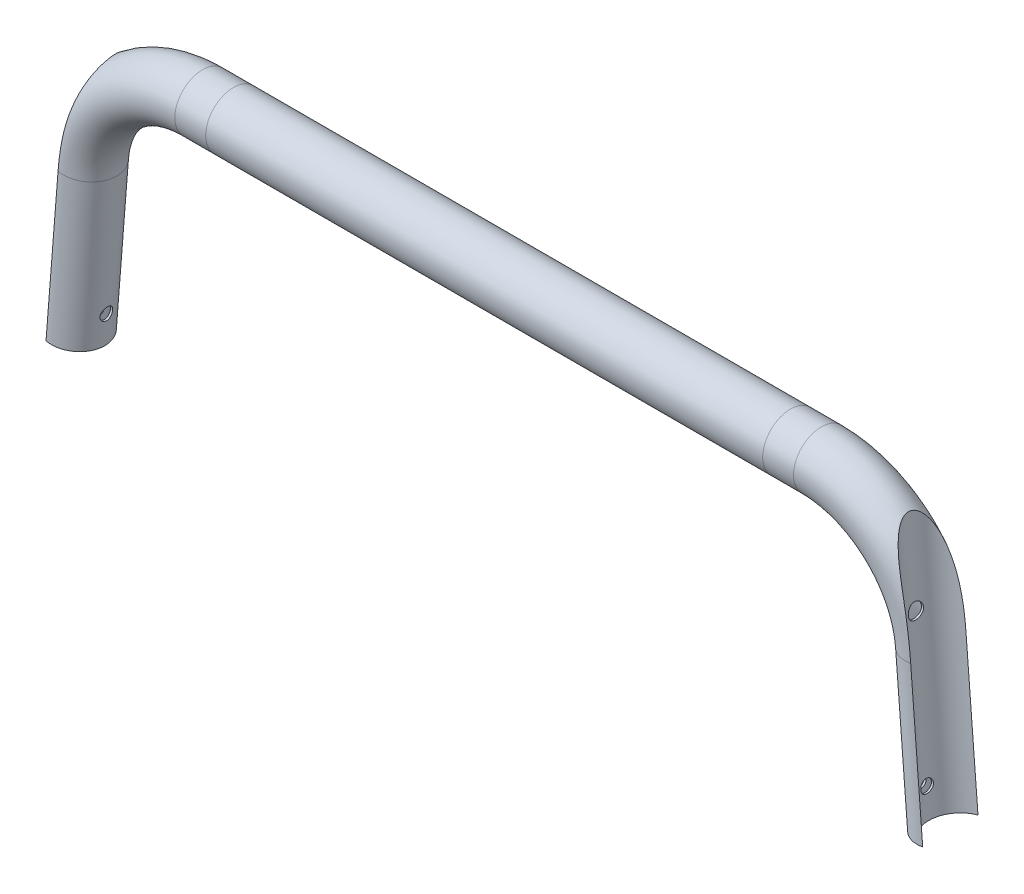
from build123d import *

# Parameters (mm, degrees)
SKETCH2_R               = 11
SKETCH2_R_2             = 10.2
SKETCH3_R               = 11.23581799789534
CUT_EXTRUDE1_DEPTH      = 230.5845222963601
BOSS_EXTRUDE1_REACH     = 223.606
CUT_EXTRUDE2_REACH      = 365.113
CUT_EXTRUDE2_END_RADIUS = 11.00000000000001
SKETCH8_R               = 2.5000000000000004
CUT_EXTRUDE3_REACH      = 369.953
CUT_EXTRUDE3_END_RADIUS = 12.035817997895382
SKETCH9_R               = 3.000000000000001


with BuildPart() as part:
    # Sweep1: sweep along a path in Sketch1
    with BuildLine(Plane.XY) as sweep1_path:
        Line((-171.8, -101.9), (-167.04400396794307, -41.46934069224712))
        ThreePointArc((-167.04400396794307, -41.46934069224712), (-152.7287574989347, -11.955487075394196), (-122.18272394995228, 0))
        Line((-122.18272394995228, 0), (-110, 1.01e-15))
        Line((-110, 1.01e-15), (110, 1.01e-15))
        Line((110, 1.01e-15), (122.18272394995228, 0))
        ThreePointArc((122.18272394995228, 0), (152.72875749893473, -11.955487075394181), (167.04400396794307, -41.46934069224712))
        Line((167.04400396794307, -41.46934069224712), (171.8, -101.9))
    # Sketch2 → Sweep1 (sweep)
    with BuildSketch(Plane(origin=(-171.79999999999998, -101.90000000000002, 0), x_dir=(-0.9969173337331282, 0.07845909572784168, 0), z_dir=(-0.07845909572784168, -0.9969173337331282, 0))):
        Circle(SKETCH2_R)
        Circle(SKETCH2_R_2, mode=Mode.SUBTRACT)
    sweep(path=sweep1_path.line)

    # Sketch3 → Cut-Extrude1 (cut, through all)
    with BuildSketch(Plane(origin=(9.02790753667694, -114.71044150027745, 0), x_dir=(0.9969173337331282, 0.07845909572784168, 0), z_dir=(0.07845909572784168, -0.9969173337331282, 0))):
        with Locations((167.27541608068444, 0)):
            Circle(SKETCH3_R)
    cut_extrude1 = extrude(amount=-CUT_EXTRUDE1_DEPTH, mode=Mode.SUBTRACT)

    # Mirror1: Cut-Extrude1 across plane
    add(cut_extrude1.mirror(Plane(origin=(0, 0, 0), x_dir=(0, 0, 1), z_dir=(1, 0, 0))), mode=Mode.SUBTRACT)

    # Sketch6 → Boss-Extrude1 (add, up to next)
    with BuildSketch(Plane(origin=(9.027907536676944, -114.71044150027747, 0), x_dir=(0.9969173337331283, 0.07845909572784171, 0), z_dir=(0.07845909572784171, -0.9969173337331283, 0)), mode=Mode.PRIVATE) as boss_extrude1_sk1:
        with BuildLine():
            ThreePointArc((163.21850968110442, 10.477839307169974), (156.03959808278907, 1.38e-15), (163.21850968110442, -10.477839307169974))
            ThreePointArc((163.21850968110442, -10.477839307169974), (162.0472251297871, -10.405762916447943), (160.89134608152528, -10.203164466198636))
            ThreePointArc((160.89134608152528, -10.203164466198636), (155.23959808278906, 1.216e-14), (160.8913460815253, 10.203164466198638))
            ThreePointArc((160.8913460815253, 10.203164466198638), (162.04722512978714, 10.405762916447944), (163.21850968110442, 10.477839307169974))
        make_face()
    boss_extrude1_tool1 = extrude(boss_extrude1_sk1.sketch, amount=-BOSS_EXTRUDE1_REACH, mode=Mode.PRIVATE) - part.part
    boss_extrude1 = boss_extrude1_tool1.solids().sort_by_distance((170.601798, -101.994301, -10.183076))[0]
    add(boss_extrude1)

    # Mirror2: Boss-Extrude1 across plane
    add(boss_extrude1.mirror(Plane(origin=(0, 0, 0), x_dir=(0, 0, 1), z_dir=(1, 0, 0))))

    # Cut-Extrude2: up to this cylinder (the profile starts inside it)
    cut_extrude2_end = Plane(origin=(170.9053944688506, -90.53295896310067, 0), z_dir=(0.07845909572784143, -0.9969173337331283, 0)) * Cylinder(CUT_EXTRUDE2_END_RADIUS, 753.226, mode=Mode.PRIVATE)
    # Sketch8 → Cut-Extrude2 (cut, up to the surface)
    with BuildSketch(Plane(origin=(171.80000000000013, -101.89999999999986, 0), x_dir=(7.6e-16, 6e-17, -1), z_dir=(0.9969173337331283, 0.0784590957278417, 0)), mode=Mode.PRIVATE) as cut_extrude2_sk1:
        with Locations(Location((0, 11.40218999047264, 0), (0, 0, 90))):
            Circle(SKETCH8_R)
    cut_extrude2_tool1 = extrude(cut_extrude2_sk1.sketch, amount=-CUT_EXTRUDE2_REACH, mode=Mode.PRIVATE) & cut_extrude2_end
    cut_extrude2 = cut_extrude2_tool1.solids().sort_by_distance((170.905394, -90.532959, 0))[0]
    add(cut_extrude2, mode=Mode.SUBTRACT)

    # Mirror3: Cut-Extrude2 across plane
    add(cut_extrude2.mirror(Plane(origin=(0, 0, 0), x_dir=(0, 0, 1), z_dir=(1, 0, 0))), mode=Mode.SUBTRACT)

    # Cut-Extrude3: up to this cylinder (the profile starts inside it)
    cut_extrude3_end = Plane(origin=(170.48377311118142, -34.19377229868032, 0), z_dir=(0.07845909572784171, -0.9969173337331282, 0)) * Cylinder(CUT_EXTRUDE3_END_RADIUS, 764.9776359957907, mode=Mode.PRIVATE)
    # Sketch9 → Cut-Extrude3 (cut, up to the surface)
    with BuildSketch(Plane(origin=(180, 0, 0), x_dir=(0, 0, -1), z_dir=(1, 0, 0)), mode=Mode.PRIVATE) as cut_extrude3_sk1:
        with Locations((0, -33.444829311783664)):
            Circle(SKETCH9_R)
    cut_extrude3_tool1 = extrude(cut_extrude3_sk1.sketch, amount=-CUT_EXTRUDE3_REACH, mode=Mode.PRIVATE) & cut_extrude3_end
    add(cut_extrude3_tool1.solids().sort_by_distance((180, -33.444829, 0))[0], mode=Mode.SUBTRACT)


solid = part.part
